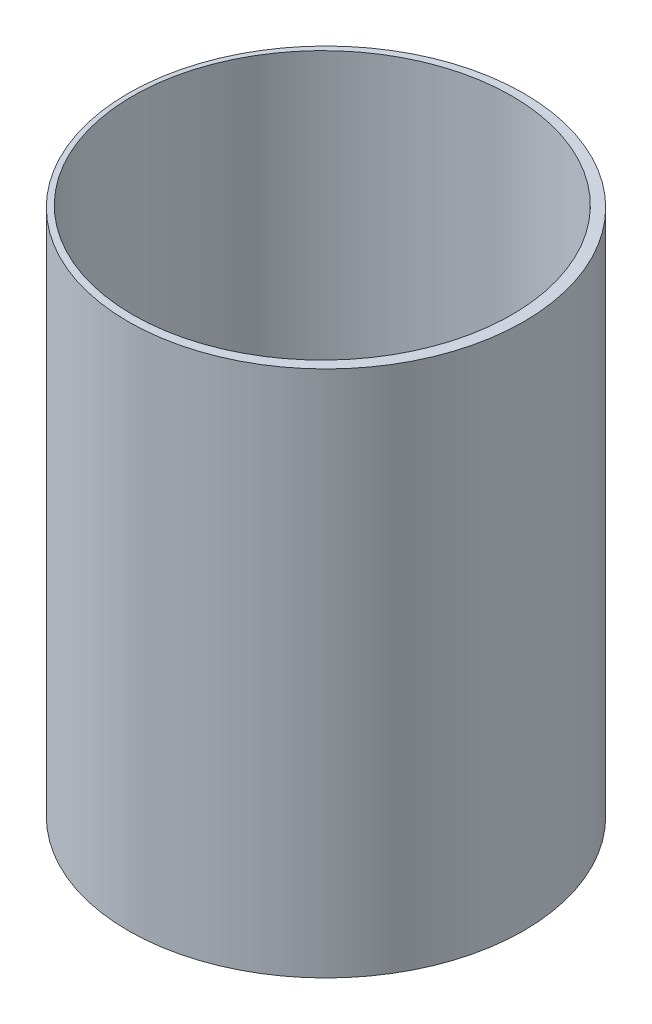
from build123d import *

# Parameters (mm, degrees)
SKETCH1_R           = 57.15
BOSS_EXTRUDE1_DEPTH = 152.4
SKETCH4_R           = 54.76875
CUT_EXTRUDE2_DEPTH  = 254


with BuildPart() as part:
    # Sketch1 → Boss-Extrude1 (new body)
    with BuildSketch(Plane(origin=(0, 0, 0), x_dir=(1, 0, 0), z_dir=(0, 1, 0))):
        with Locations(Location((0, 0, 0), (0, 0, 90))):
            Circle(SKETCH1_R)
    extrude(amount=BOSS_EXTRUDE1_DEPTH)

    # Sketch4 → Cut-Extrude2 (cut)
    with BuildSketch(Plane(origin=(0, 152.4, 0), x_dir=(1, 0, 0), z_dir=(0, 1, 0))):
        with Locations(Location((-1.063665342, 0, 0), (0, 0, 270))):
            Circle(SKETCH4_R)
    extrude(amount=-CUT_EXTRUDE2_DEPTH, mode=Mode.SUBTRACT)


solid = part.part
